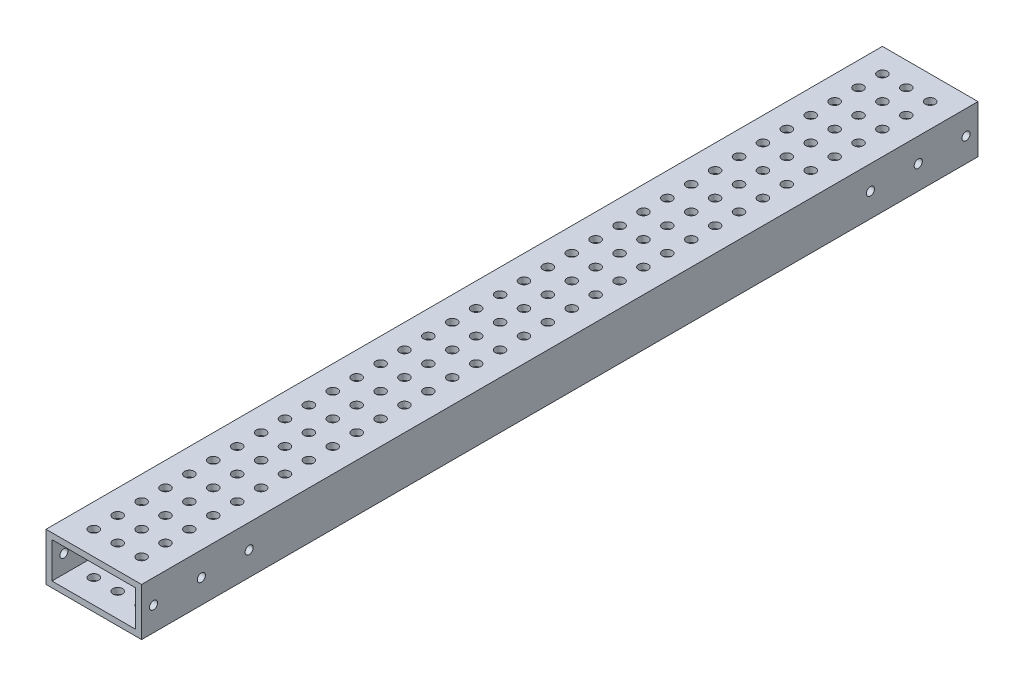
from build123d import *

# Parameters (mm, degrees)
SKETCH1_W           = 50.8
SKETCH1_H           = 25.4
SKETCH1_W_2         = 44.45
SKETCH1_H_2         = 19.05
BOSS_EXTRUDE1_DEPTH = 222.25
SKETCH2_R           = 2.5527
CUT_EXTRUDE1_DEPTH  = 226.134143346
SKETCH3_R           = 2.159
CUT_EXTRUDE2_DEPTH  = 229.335263374


with BuildPart() as part:
    # Sketch1 → Boss-Extrude1 (new, symmetric)
    with BuildSketch(Plane.XY):
        Rectangle(SKETCH1_W, SKETCH1_H)
        Rectangle(SKETCH1_W_2, SKETCH1_H_2, mode=Mode.SUBTRACT)
    extrude(amount=BOSS_EXTRUDE1_DEPTH, both=True)

    # Sketch2 → Cut-Extrude1 (cut, through all)
    with BuildSketch(Plane(origin=(0, 12.7, 0), x_dir=(1, 0, 0), z_dir=(0, 1, 0))):
        with Locations(Location((0, -209.55, 0), (0, 0, 270))):
            Circle(SKETCH2_R)
        with Locations(Location((12.7, -209.55, 0), (0, 0, 270))):
            Circle(SKETCH2_R)
        with Locations(Location((-12.7, -209.55, 0), (0, 0, 270))):
            Circle(SKETCH2_R)
        with Locations(Location((-12.7, -196.85, 0), (0, 0, 270))):
            Circle(SKETCH2_R)
        with Locations(Location((0, -196.85, 0), (0, 0, 270))):
            Circle(SKETCH2_R)
        with Locations(Location((12.7, -196.85, 0), (0, 0, 270))):
            Circle(SKETCH2_R)
        with Locations(Location((-12.7, -184.15, 0), (0, 0, 270))):
            Circle(SKETCH2_R)
        with Locations(Location((0, -184.15, 0), (0, 0, 270))):
            Circle(SKETCH2_R)
        with Locations(Location((12.7, -184.15, 0), (0, 0, 270))):
            Circle(SKETCH2_R)
        with Locations(Location((-12.7, -171.45, 0), (0, 0, 270))):
            Circle(SKETCH2_R)
        with Locations(Location((0, -171.45, 0), (0, 0, 270))):
            Circle(SKETCH2_R)
        with Locations(Location((12.7, -171.45, 0), (0, 0, 270))):
            Circle(SKETCH2_R)
        with Locations(Location((-12.7, -158.75, 0), (0, 0, 270))):
            Circle(SKETCH2_R)
        with Locations(Location((0, -158.75, 0), (0, 0, 270))):
            Circle(SKETCH2_R)
        with Locations(Location((12.7, -158.75, 0), (0, 0, 270))):
            Circle(SKETCH2_R)
        with Locations(Location((-12.7, -146.05, 0), (0, 0, 270))):
            Circle(SKETCH2_R)
        with Locations(Location((0, -146.05, 0), (0, 0, 270))):
            Circle(SKETCH2_R)
        with Locations(Location((12.7, -146.05, 0), (0, 0, 270))):
            Circle(SKETCH2_R)
        with Locations(Location((-12.7, -133.35, 0), (0, 0, 270))):
            Circle(SKETCH2_R)
        with Locations(Location((0, -133.35, 0), (0, 0, 270))):
            Circle(SKETCH2_R)
        with Locations(Location((12.7, -133.35, 0), (0, 0, 270))):
            Circle(SKETCH2_R)
        with Locations(Location((-12.7, -120.65, 0), (0, 0, 270))):
            Circle(SKETCH2_R)
        with Locations(Location((0, -120.65, 0), (0, 0, 270))):
            Circle(SKETCH2_R)
        with Locations(Location((12.7, -120.65, 0), (0, 0, 270))):
            Circle(SKETCH2_R)
        with Locations(Location((-12.7, -107.95, 0), (0, 0, 270))):
            Circle(SKETCH2_R)
        with Locations(Location((0, -107.95, 0), (0, 0, 270))):
            Circle(SKETCH2_R)
        with Locations(Location((12.7, -107.95, 0), (0, 0, 270))):
            Circle(SKETCH2_R)
        with Locations(Location((-12.7, -95.25, 0), (0, 0, 270))):
            Circle(SKETCH2_R)
        with Locations(Location((0, -95.25, 0), (0, 0, 270))):
            Circle(SKETCH2_R)
        with Locations(Location((12.7, -95.25, 0), (0, 0, 270))):
            Circle(SKETCH2_R)
        with Locations(Location((-12.7, -82.55, 0), (0, 0, 270))):
            Circle(SKETCH2_R)
        with Locations(Location((0, -82.55, 0), (0, 0, 270))):
            Circle(SKETCH2_R)
        with Locations(Location((12.7, -82.55, 0), (0, 0, 270))):
            Circle(SKETCH2_R)
        with Locations(Location((-12.7, -69.85, 0), (0, 0, 270))):
            Circle(SKETCH2_R)
        with Locations(Location((0, -69.85, 0), (0, 0, 270))):
            Circle(SKETCH2_R)
        with Locations(Location((12.7, -69.85, 0), (0, 0, 270))):
            Circle(SKETCH2_R)
        with Locations(Location((-12.7, -57.15, 0), (0, 0, 270))):
            Circle(SKETCH2_R)
        with Locations(Location((0, -57.15, 0), (0, 0, 270))):
            Circle(SKETCH2_R)
        with Locations(Location((12.7, -57.15, 0), (0, 0, 270))):
            Circle(SKETCH2_R)
        with Locations(Location((-12.7, -44.45, 0), (0, 0, 270))):
            Circle(SKETCH2_R)
        with Locations(Location((0, -44.45, 0), (0, 0, 270))):
            Circle(SKETCH2_R)
        with Locations(Location((12.7, -44.45, 0), (0, 0, 270))):
            Circle(SKETCH2_R)
        with Locations(Location((-12.7, -31.75, 0), (0, 0, 270))):
            Circle(SKETCH2_R)
        with Locations(Location((0, -31.75, 0), (0, 0, 270))):
            Circle(SKETCH2_R)
        with Locations(Location((12.7, -31.75, 0), (0, 0, 270))):
            Circle(SKETCH2_R)
        with Locations(Location((-12.7, -19.05, 0), (0, 0, 270))):
            Circle(SKETCH2_R)
        with Locations(Location((0, -19.05, 0), (0, 0, 270))):
            Circle(SKETCH2_R)
        with Locations(Location((12.7, -19.05, 0), (0, 0, 270))):
            Circle(SKETCH2_R)
        with Locations(Location((-12.7, -6.35, 0), (0, 0, 270))):
            Circle(SKETCH2_R)
        with Locations(Location((0, -6.35, 0), (0, 0, 270))):
            Circle(SKETCH2_R)
        with Locations(Location((12.7, -6.35, 0), (0, 0, 270))):
            Circle(SKETCH2_R)
        with Locations(Location((-12.7, 6.35, 0), (0, 0, 270))):
            Circle(SKETCH2_R)
        with Locations(Location((0, 6.35, 0), (0, 0, 270))):
            Circle(SKETCH2_R)
        with Locations(Location((12.7, 6.35, 0), (0, 0, 270))):
            Circle(SKETCH2_R)
        with Locations(Location((-12.7, 19.05, 0), (0, 0, 270))):
            Circle(SKETCH2_R)
        with Locations(Location((0, 19.05, 0), (0, 0, 270))):
            Circle(SKETCH2_R)
        with Locations(Location((12.7, 19.05, 0), (0, 0, 270))):
            Circle(SKETCH2_R)
        with Locations(Location((-12.7, 31.75, 0), (0, 0, 270))):
            Circle(SKETCH2_R)
        with Locations(Location((0, 31.75, 0), (0, 0, 270))):
            Circle(SKETCH2_R)
        with Locations(Location((12.7, 31.75, 0), (0, 0, 270))):
            Circle(SKETCH2_R)
        with Locations(Location((-12.7, 44.45, 0), (0, 0, 270))):
            Circle(SKETCH2_R)
        with Locations(Location((0, 44.45, 0), (0, 0, 270))):
            Circle(SKETCH2_R)
        with Locations(Location((12.7, 44.45, 0), (0, 0, 270))):
            Circle(SKETCH2_R)
        with Locations(Location((-12.7, 57.15, 0), (0, 0, 270))):
            Circle(SKETCH2_R)
        with Locations(Location((0, 57.15, 0), (0, 0, 270))):
            Circle(SKETCH2_R)
        with Locations(Location((12.7, 57.15, 0), (0, 0, 270))):
            Circle(SKETCH2_R)
        with Locations(Location((-12.7, 69.85, 0), (0, 0, 270))):
            Circle(SKETCH2_R)
        with Locations(Location((0, 69.85, 0), (0, 0, 270))):
            Circle(SKETCH2_R)
        with Locations(Location((12.7, 69.85, 0), (0, 0, 270))):
            Circle(SKETCH2_R)
        with Locations(Location((-12.7, 82.55, 0), (0, 0, 270))):
            Circle(SKETCH2_R)
        with Locations(Location((0, 82.55, 0), (0, 0, 270))):
            Circle(SKETCH2_R)
        with Locations(Location((12.7, 82.55, 0), (0, 0, 270))):
            Circle(SKETCH2_R)
        with Locations(Location((-12.7, 95.25, 0), (0, 0, 270))):
            Circle(SKETCH2_R)
        with Locations(Location((0, 95.25, 0), (0, 0, 270))):
            Circle(SKETCH2_R)
        with Locations(Location((12.7, 95.25, 0), (0, 0, 270))):
            Circle(SKETCH2_R)
        with Locations(Location((-12.7, 107.95, 0), (0, 0, 270))):
            Circle(SKETCH2_R)
        with Locations(Location((0, 107.95, 0), (0, 0, 270))):
            Circle(SKETCH2_R)
        with Locations(Location((12.7, 107.95, 0), (0, 0, 270))):
            Circle(SKETCH2_R)
        with Locations(Location((-12.7, 120.65, 0), (0, 0, 270))):
            Circle(SKETCH2_R)
        with Locations(Location((0, 120.65, 0), (0, 0, 270))):
            Circle(SKETCH2_R)
        with Locations(Location((12.7, 120.65, 0), (0, 0, 270))):
            Circle(SKETCH2_R)
        with Locations(Location((-12.7, 133.35, 0), (0, 0, 270))):
            Circle(SKETCH2_R)
        with Locations(Location((0, 133.35, 0), (0, 0, 270))):
            Circle(SKETCH2_R)
        with Locations(Location((12.7, 133.35, 0), (0, 0, 270))):
            Circle(SKETCH2_R)
        with Locations(Location((-12.7, 146.05, 0), (0, 0, 270))):
            Circle(SKETCH2_R)
        with Locations(Location((0, 146.05, 0), (0, 0, 270))):
            Circle(SKETCH2_R)
        with Locations(Location((12.7, 146.05, 0), (0, 0, 270))):
            Circle(SKETCH2_R)
        with Locations(Location((-12.7, 158.75, 0), (0, 0, 270))):
            Circle(SKETCH2_R)
        with Locations(Location((0, 158.75, 0), (0, 0, 270))):
            Circle(SKETCH2_R)
        with Locations(Location((12.7, 158.75, 0), (0, 0, 270))):
            Circle(SKETCH2_R)
        with Locations(Location((-12.7, 171.45, 0), (0, 0, 270))):
            Circle(SKETCH2_R)
        with Locations(Location((0, 171.45, 0), (0, 0, 270))):
            Circle(SKETCH2_R)
        with Locations(Location((12.7, 171.45, 0), (0, 0, 270))):
            Circle(SKETCH2_R)
        with Locations(Location((-12.7, 184.15, 0), (0, 0, 270))):
            Circle(SKETCH2_R)
        with Locations(Location((0, 184.15, 0), (0, 0, 270))):
            Circle(SKETCH2_R)
        with Locations(Location((12.7, 184.15, 0), (0, 0, 270))):
            Circle(SKETCH2_R)
        with Locations(Location((-12.7, 196.85, 0), (0, 0, 270))):
            Circle(SKETCH2_R)
        with Locations(Location((0, 196.85, 0), (0, 0, 270))):
            Circle(SKETCH2_R)
        with Locations(Location((12.7, 196.85, 0), (0, 0, 270))):
            Circle(SKETCH2_R)
        with Locations(Location((-12.7, 209.55, 0), (0, 0, 270))):
            Circle(SKETCH2_R)
        with Locations(Location((0, 209.55, 0), (0, 0, 270))):
            Circle(SKETCH2_R)
        with Locations(Location((12.7, 209.55, 0), (0, 0, 270))):
            Circle(SKETCH2_R)
    extrude(amount=-CUT_EXTRUDE1_DEPTH, mode=Mode.SUBTRACT)

    # Sketch3 → Cut-Extrude2 (cut, through all)
    with BuildSketch(Plane(origin=(25.4, 0, 0), x_dir=(0, 0, -1), z_dir=(1, 0, 0))):
        with Locations(Location((-215.9, 0, 0), (0, 0, 90))):
            Circle(SKETCH3_R)
        with Locations(Location((-190.5, 0, 0), (0, 0, 90))):
            Circle(SKETCH3_R)
        with Locations(Location((-165.1, 0, 0), (0, 0, 90))):
            Circle(SKETCH3_R)
        with Locations(Location((215.9, 0, 0), (0, 0, 90))):
            Circle(SKETCH3_R)
        with Locations(Location((190.5, 0, 0), (0, 0, 90))):
            Circle(SKETCH3_R)
        with Locations(Location((165.1, 0, 0), (0, 0, 90))):
            Circle(SKETCH3_R)
    extrude(amount=-CUT_EXTRUDE2_DEPTH, mode=Mode.SUBTRACT)


solid = part.part
